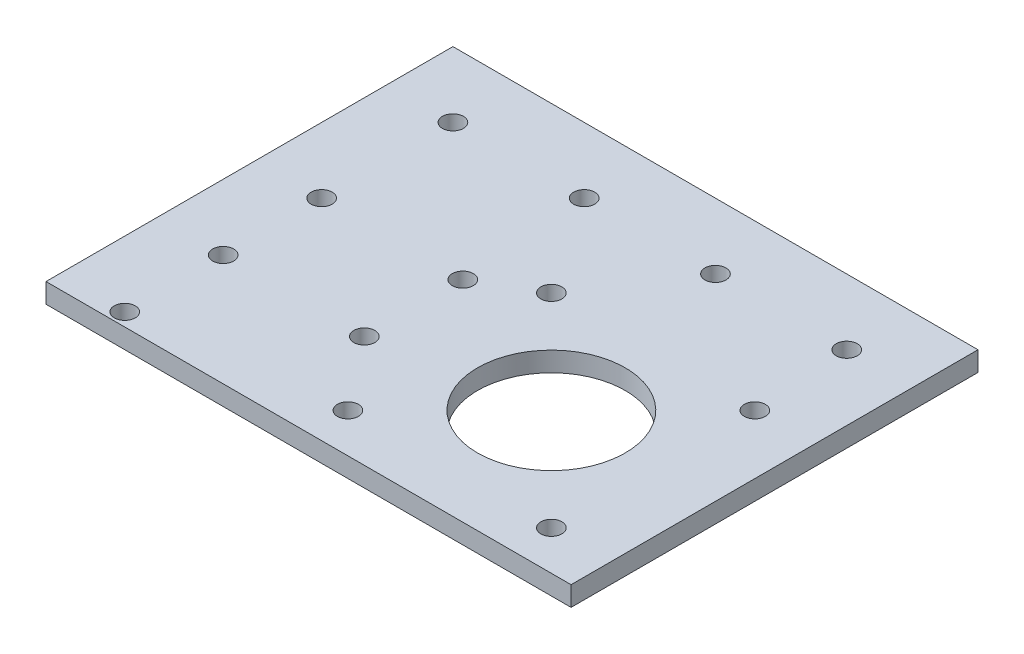
from build123d import *

# Parameters (mm, degrees)
SKETCH_1_W      = 80
SKETCH_1_H      = 62
SKETCH_1_R      = 1.6
SKETCH_1_R_2    = 11.25
EXTRUDE_1_DEPTH = 3


with BuildPart() as part:
    # 草图1 → 凸台-拉伸1 (new body)
    with BuildSketch(Plane(origin=(0, 0, 0), x_dir=(1, 0, 0), z_dir=(0, 1, 0))):
        with Locations((40, -31)):
            Rectangle(SKETCH_1_W, SKETCH_1_H)
        with Locations(Location((10, -10, 0), (0, 0, 270))):
            Circle(SKETCH_1_R, mode=Mode.SUBTRACT)
        with Locations(Location((10, -30, 0), (0, 0, 270))):
            Circle(SKETCH_1_R, mode=Mode.SUBTRACT)
        with Locations(Location((10, -45, 0), (0, 0, 270))):
            Circle(SKETCH_1_R, mode=Mode.SUBTRACT)
        with Locations(Location((10, -60, 0), (0, 0, 270))):
            Circle(SKETCH_1_R, mode=Mode.SUBTRACT)
        with Locations(Location((30, -10, 0), (0, 0, 270))):
            Circle(SKETCH_1_R, mode=Mode.SUBTRACT)
        with Locations(Location((71, -25, 0), (0, 0, 270))):
            Circle(SKETCH_1_R, mode=Mode.SUBTRACT)
        with Locations(Location((40, -25, 0), (0, 0, 270))):
            Circle(SKETCH_1_R, mode=Mode.SUBTRACT)
        with Locations(Location((40, -56, 0), (0, 0, 270))):
            Circle(SKETCH_1_R, mode=Mode.SUBTRACT)
        with Locations(Location((71, -56, 0), (0, 0, 270))):
            Circle(SKETCH_1_R, mode=Mode.SUBTRACT)
        with Locations(Location((55.5, -40.5, 0), (0, 0, 270))):
            Circle(SKETCH_1_R_2, mode=Mode.SUBTRACT)
        with Locations(Location((50, -10, 0), (0, 0, 270))):
            Circle(SKETCH_1_R, mode=Mode.SUBTRACT)
        with Locations(Location((70, -10, 0), (0, 0, 270))):
            Circle(SKETCH_1_R, mode=Mode.SUBTRACT)
        with Locations(Location((31.5, -30, 0), (0, 0, 270))):
            Circle(SKETCH_1_R, mode=Mode.SUBTRACT)
        with Locations(Location((31.5, -45, 0), (0, 0, 270))):
            Circle(SKETCH_1_R, mode=Mode.SUBTRACT)
    extrude(amount=EXTRUDE_1_DEPTH)


solid = part.part
